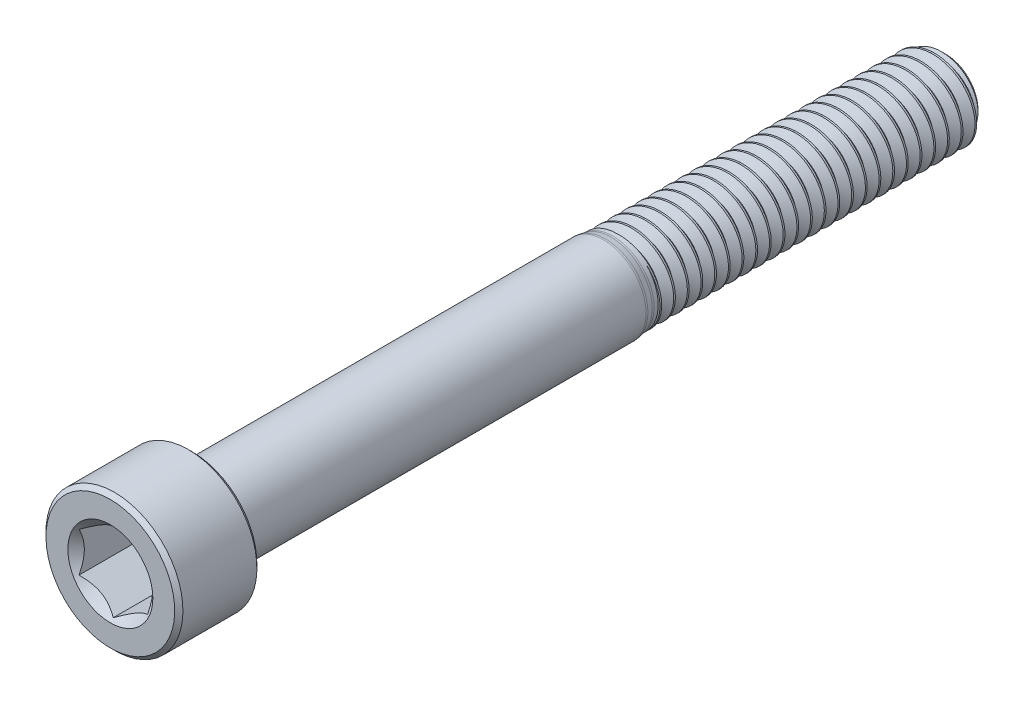
from build123d import *

# Parameters (mm, degrees)
CUT_EXTRUDE1_DEPTH     = 5
SKETCH4_R              = 3.103257697
CUT_EXTRUDE2_DEPTH     = 3
CUT_EXTRUDE2_DRAFT     = -45
SPLIT1_SURFACE_1_BACK  = 63.618
SPLIT1_SURFACE_1_DEPTH = 127.236
SPLIT1_SURFACE_2_BACK  = 63.618
SPLIT1_SURFACE_2_DEPTH = 127.236
CUT_SWEEP1_PITCH       = 1
CUT_SWEEP1_HEIGHT      = 25
CUT_SWEEP1_RADIUS      = 3
CUT_SWEEP1_START_ANGLE = 90


with BuildPart() as part:
    # Sketch2 → Revolve1 (revolve)
    with BuildSketch(Plane(origin=(0, 0, 0), x_dir=(0, 0, -1), z_dir=(1, 0, 0))):
        with BuildLine():
            Line((-30.5, 0), (-30.5, 4.7))
            Line((-30.5, 4.7), (-30.2, 5))
            Line((-30.2, 5), (-24.8, 5))
            Line((-24.8, 5), (-24.5, 4.7))
            Line((-24.5, 4.7), (-24.5, 3.408253175))
            ThreePointArc((-24.5, 3.408253175), (-24.412132034, 3.196121141), (-24.2, 3.108253175))
            Line((-24.2, 3.108253175), (5.506905983, 3.108253175))
            ThreePointArc((5.506905983, 3.108253175), (5.580418839, 3.10464172), (5.653223725, 3.093842136))
            Line((5.653223725, 3.093842136), (6.052550811, 3.01441104))
            ThreePointArc((6.052550811, 3.01441104), (6.125355697, 3.003611455), (6.198868553, 3))
            Line((6.198868553, 3), (29.850480947, 3))
            Line((29.850480947, 3), (30.5, 2.350480947))
            Line((30.5, 2.350480947), (30.5, 0))
            Line((30.5, 0), (-30.5, 0))
        make_face()
    revolve(axis=Axis((0, 0, -30.5), (0, 0, 1)))

    # Sketch3 → Cut-Extrude1 (cut)
    with BuildSketch(Plane.XY.offset(30.5)):
        Polygon((2.5, -1.443375673), (2.5, 1.443375673), (0, 2.886751346), (-2.5, 1.443375673), (-2.5, -1.443375673), (0, -2.886751346), align=None)
    extrude(amount=-CUT_EXTRUDE1_DEPTH, mode=Mode.SUBTRACT)


with BuildPart() as cut_extrude2_tool:
    # Sketch4 → Cut-Extrude2 (with draft: the straight prism first)
    with BuildSketch(Plane.XY.offset(30.5)):
        Circle(SKETCH4_R)
    extrude(amount=-CUT_EXTRUDE2_DEPTH)
    # Cut-Extrude2: the draft: its side faces are tilted about the plane it starts from
    cut_extrude2_sides = [cut_extrude2_tool.faces().sort_by_distance(p)[0] for p in [
        (-3.103257697, 0, 29),
    ]]
    draft(cut_extrude2_sides, Plane.XY.offset(30.5), CUT_EXTRUDE2_DRAFT)


with BuildPart() as part_1:
    add(part.part)

    # Cut-Extrude2: cut by cut_extrude2_tool
    add(cut_extrude2_tool.part, mode=Mode.SUBTRACT)


with BuildPart() as body_2:
    # Split1: the piece behind the surface
    add(part_1.part)
    # Split1 surface: a surface, the sketch's curves swept straight by 127.236 mm
    with BuildLine(Plane(origin=(0, 0, 0), x_dir=(0, 0, -1), z_dir=(1, 0, 0)).offset(-SPLIT1_SURFACE_1_BACK), mode=Mode.PRIVATE) as split1_surface_1_path:
        Line((6.5, -3), (6.5, 3))
    split1_surface_1 = Shell.extrude(split1_surface_1_path.wire(), (1 * SPLIT1_SURFACE_1_DEPTH, 0 * SPLIT1_SURFACE_1_DEPTH, 0 * SPLIT1_SURFACE_1_DEPTH))
    split(bisect_by=split1_surface_1, keep=Keep.BOTTOM)

    # Cut-Sweep1: sweep along a helix
    with BuildLine() as cut_sweep1_path:
        add(Helix(CUT_SWEEP1_PITCH, CUT_SWEEP1_HEIGHT, CUT_SWEEP1_RADIUS, center=(0, 0, -30.5), direction=(0, 0, 1), mode=Mode.PRIVATE).rotate(Axis((0, 0, -30.5), (0, 0, 1)), CUT_SWEEP1_START_ANGLE))
    # Sketch7 → Cut-Sweep1 (sweep, cut)
    with BuildSketch(Plane(origin=(0, 0, 0), x_dir=(0, 0, -1), z_dir=(1, 0, 0))):
        Polygon((30.46875, 3.054126588), (31.40625, 3.054126588), (31, 2.350480947), (30.875, 2.350480947), align=None)
    sweep(path=cut_sweep1_path.line, is_frenet=True, mode=Mode.SUBTRACT)


with BuildPart() as part_2:
    add(part_1.part)

    # Split1: split by a surface, the side it looks to stays
    # Split1 surface: a surface, the sketch's curves swept straight by 127.236 mm
    with BuildLine(Plane(origin=(0, 0, 0), x_dir=(0, 0, -1), z_dir=(1, 0, 0)).offset(-SPLIT1_SURFACE_2_BACK), mode=Mode.PRIVATE) as split1_surface_2_path:
        Line((6.5, -3), (6.5, 3))
    split1_surface_2 = Shell.extrude(split1_surface_2_path.wire(), (1 * SPLIT1_SURFACE_2_DEPTH, 0 * SPLIT1_SURFACE_2_DEPTH, 0 * SPLIT1_SURFACE_2_DEPTH))
    split(bisect_by=split1_surface_2, keep=Keep.TOP)

    add(body_2.part)  # Revolve2 merges body 2
    # Sketch8 → Revolve2 (revolve)
    with BuildSketch(Plane(origin=(0, 0, 0), x_dir=(0, 0, -1), z_dir=(1, 0, 0))):
        Polygon((-24.5, 0), (-24.5, 3), (6.5, 3), (8.232050808, 0), align=None)
    revolve(axis=Axis((0, 0, -8.232050808), (0, 0, 1)))


solid = part_2.part
